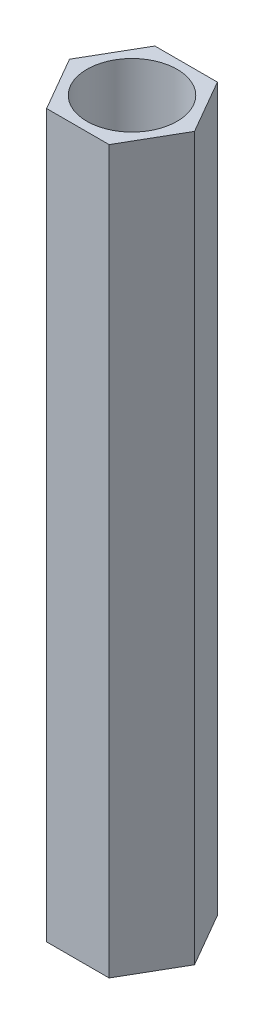
from build123d import *

# Parameters (mm, degrees)
SKETCH1_R           = 2.5
BOSS_EXTRUDE1_DEPTH = 20


with BuildPart() as part:
    # Sketch1 → Boss-Extrude1 (new, symmetric)
    with BuildSketch(Plane(origin=(0, 0, 0), x_dir=(1, 0, 0), z_dir=(0, 1, 0))):
        Polygon((1.732050808, 3), (-1.732050808, 3), (-3.464101615, 0), (-1.732050808, -3), (1.732050808, -3), (3.464101615, 0), align=None)
        with Locations(Location((0, 0, 0), (0, 0, 270))):
            Circle(SKETCH1_R, mode=Mode.SUBTRACT)
    extrude(amount=BOSS_EXTRUDE1_DEPTH, both=True)


solid = part.part
